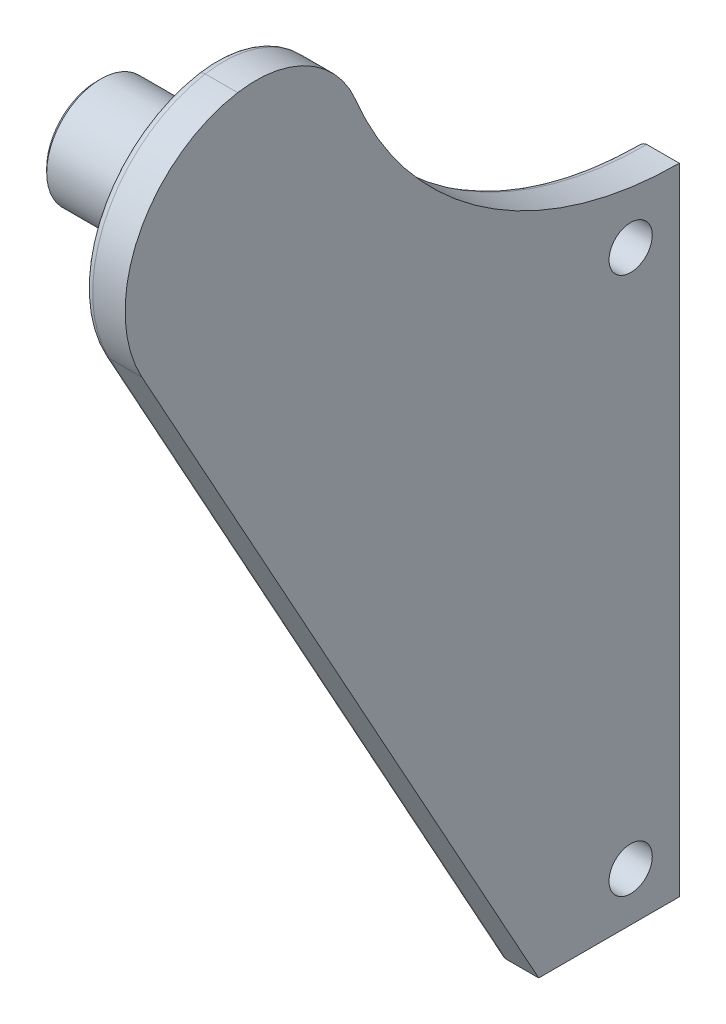
from build123d import *

# Parameters (mm, degrees)
AUFSATZ_LINEAR_AUSTRAGEN1_DEPTH = 3
SKIZZE2_R                       = 4
AUFSATZ_LINEAR_AUSTRAGEN2_DEPTH = 9.1
FASE1_SIZE                      = 0.3
SKIZZE3_R                       = 1.6
SCHNITT_LINEAR_AUSTRAGEN1_DEPTH = 6
SKIZZE4_R                       = 7
AUFSATZ_LINEAR_AUSTRAGEN3_DEPTH = 1.2
VERRUNDUNG1_R                   = 1
SCHNITT_LINEAR_AUSTRAGEN2_DEPTH = 10
VERRUNDUNG3_R                   = 8
VERRUNDUNG4_R                   = 0.6
VERRUNDUNG5_R                   = 0.6


with BuildPart() as part:
    # Skizze1 → Aufsatz-Linear austragen1 (new body)
    with BuildSketch(Plane(origin=(0, 0, 0), x_dir=(0, 0, -1), z_dir=(1, 0, 0))):
        with BuildLine():
            Line((31, -11), (31, -58))
            Line((31, -58), (20.6, -58))
            Line((20.6, -58), (-8.754311744, -4.833427964))
            ThreePointArc((-8.754311744, -4.833427964), (-6.538746444, 7.566029007), (6.05088421, 7.961582774))
            Line((6.05088421, 7.961582774), (31, -11))
        make_face()
    extrude(amount=AUFSATZ_LINEAR_AUSTRAGEN1_DEPTH)

    # Skizze2 → Aufsatz-Linear austragen2 (add)
    with BuildSketch(Plane.ZY):
        with Locations(Location((0, 0, 0), (0, 0, 180))):
            Circle(SKIZZE2_R)
    extrude(amount=AUFSATZ_LINEAR_AUSTRAGEN2_DEPTH)

    # Fase1
    fase1_edges = [part.edges().sort_by_distance(p)[0] for p in [
        (-9.1, 0, 4),
    ]]
    chamfer(fase1_edges, length=FASE1_SIZE)

    # Skizze3 → Schnitt-Linear austragen1 (cut)
    with BuildSketch(Plane(origin=(3, 0, 0), x_dir=(0, 0, -1), z_dir=(1, 0, 0))):
        with Locations((27.4, -54.4)):
            Circle(SKIZZE3_R)
        with Locations((27.4, -14.6)):
            Circle(SKIZZE3_R)
    extrude(amount=-SCHNITT_LINEAR_AUSTRAGEN1_DEPTH, mode=Mode.SUBTRACT)

    # Skizze4 → Aufsatz-Linear austragen3 (add)
    with BuildSketch(Plane.ZY):
        with Locations(Location((0, 0, 0), (0, 0, 180))):
            Circle(SKIZZE4_R)
    extrude(amount=AUFSATZ_LINEAR_AUSTRAGEN3_DEPTH)

    # Verrundung1
    verrundung1_edges = [part.edges().sort_by_distance(p)[0] for p in [
        (0, 0, 7),
    ]]
    fillet(verrundung1_edges, radius=VERRUNDUNG1_R)

    # Skizze5 → Schnitt-Linear austragen2 (cut)
    with BuildSketch(Plane.ZY):
        with BuildLine():
            ThreePointArc((-31, -11), (-15.331560384, -5.721628096), (-6.05088421, 7.961582774))
            Line((-6.05088421, 7.961582774), (-31, -11))
        make_face()
    extrude(amount=-SCHNITT_LINEAR_AUSTRAGEN2_DEPTH, mode=Mode.SUBTRACT)

    # Verrundung3
    verrundung3_edges = [part.edges().sort_by_distance(p)[0] for p in [
        (1.5, 7.961582774, -6.05088421),
    ]]
    fillet(verrundung3_edges, radius=VERRUNDUNG3_R)

    # Verrundung4
    verrundung4_edges = [part.edges().sort_by_distance(p)[0] for p in [
        (0, -6.624911651, -16.597231966),
        (0, -34.5, -31),
        (0, 4.342309459, 9.008015795),
        (0, 8.970000491, -3.541995713),
        (0, -58, -25.8),
        (0, -31.416713982, -5.922844128),
    ]]
    fillet(verrundung4_edges, radius=VERRUNDUNG4_R)

    # Verrundung5
    verrundung5_edges = [part.edges().sort_by_distance(p)[0] for p in [
        (-1.2, 0, 7),
    ]]
    fillet(verrundung5_edges, radius=VERRUNDUNG5_R)


solid = part.part
